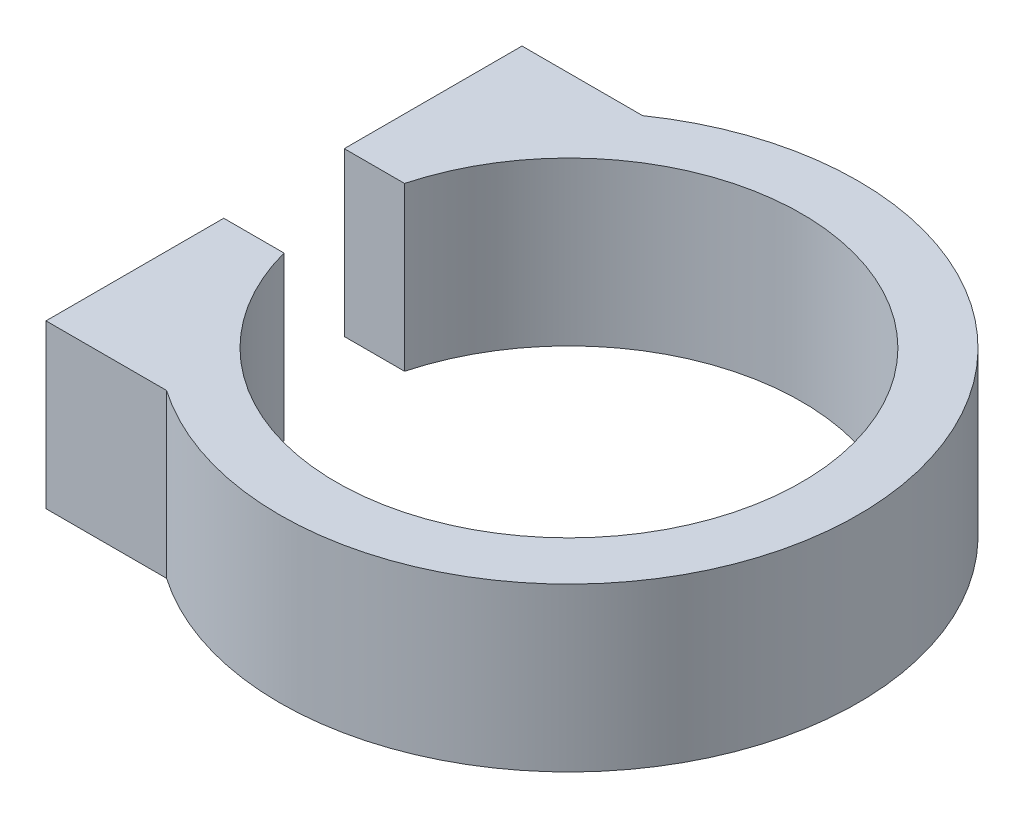
from build123d import *

# Parameters (mm, degrees)
BOSS_EXTRUDE1_DEPTH = 13.5


with BuildPart() as part:
    # Sketch1 → Boss-Extrude1 (new body)
    with BuildSketch(Plane(origin=(0, 0, 0), x_dir=(1, 0, 0), z_dir=(0, 1, 0))):
        with BuildLine():
            Line((-23.641083659, 5), (-23.641083659, 19.746413259))
            Line((-23.641083659, 19.746413259), (-13.641083659, 19.746413259))
            ThreePointArc((-13.641083659, 19.746413259), (24, 0), (-13.641083659, -19.746413259))
            Line((-13.641083659, -19.746413259), (-23.641083659, -19.746413259))
            Line((-23.641083659, -19.746413259), (-23.641083659, -5))
            Line((-23.641083659, -5), (-18.641083659, -5))
            ThreePointArc((-18.641083659, -5), (19.3, 0), (-18.641083659, 5))
            Line((-18.641083659, 5), (-23.641083659, 5))
        make_face()
    extrude(amount=BOSS_EXTRUDE1_DEPTH)


solid = part.part
